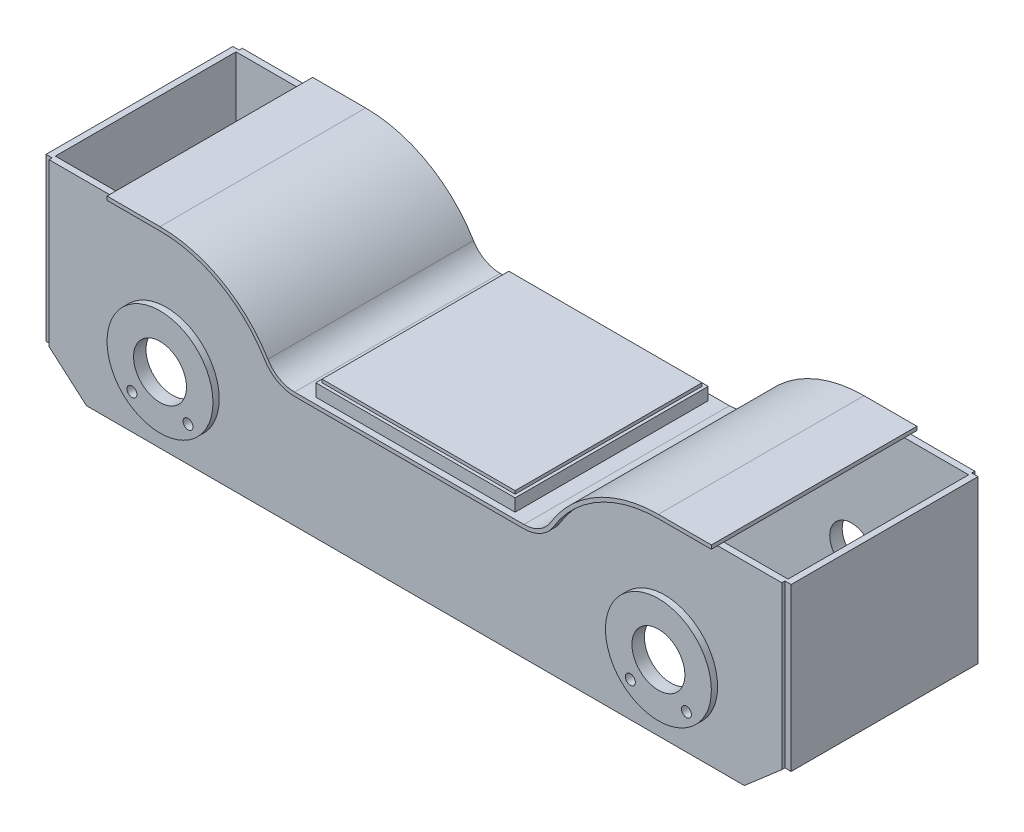
from build123d import *

# Parameters (mm, degrees)
SKETCH_1_R          = 35
SKETCH_1_R_2        = 8
EXTRUDE_1_DEPTH     = 310
SKETCH_2_W          = 1176
SKETCH_2_H          = 290
CUT_EXTRUDE_1_DEPTH = 735.294218961
EXTRUDE_2_DEPTH     = 330
SKETCH_4_R          = 42.5
CUT_EXTRUDE_2_DEPTH = 10
SKETCH_5_R          = 85
SKETCH_5_R_2        = 42.5
SKETCH_5_R_3        = 8
EXTRUDE_3_DEPTH     = 10
SKETCH_6_R          = 85
SKETCH_6_R_2        = 8
SKETCH_6_R_3        = 35
EXTRUDE_4_DEPTH     = 10
SKETCH_7_W          = 10
SKETCH_7_H          = 290
EXTRUDE_5_DEPTH     = 184
SKETCH_8_W          = 420
SKETCH_8_H          = 290
EXTRUDE_6_DEPTH     = 6
SKETCH_9_W          = 10
SKETCH_9_H          = 300
EXTRUDE_7_DEPTH     = 260
SKETCH_10_W         = 320
SKETCH_10_H         = 310
EXTRUDE_8_DEPTH     = 20
SKETCH_11_W         = 310
SKETCH_11_H         = 300
EXTRUDE_9_DEPTH     = 5


with BuildPart() as part:
    # 草图1 → 凸台-拉伸1 (new body)
    with BuildSketch(Plane.XY):
        with BuildLine():
            Line((0, 0), (0, 190))
            Line((0, 190), (184, 190))
            ThreePointArc((184, 190), (211.540328216, 197.240074634), (231.959441014, 217.088202795))
            ThreePointArc((231.959441014, 217.088202795), (303.504043203, 286.632185805), (400, 312))
            Line((400, 312), (588, 312))
            Line((588, 312), (588, 52))
            Line((588, 52), (528, 0))
            Line((528, 0), (0, 0))
        make_face()
        with Locations((400, 116)):
            Circle(SKETCH_1_R, mode=Mode.SUBTRACT)
        with Locations((355, 66)):
            Circle(SKETCH_1_R_2, mode=Mode.SUBTRACT)
        with Locations((445, 66)):
            Circle(SKETCH_1_R_2, mode=Mode.SUBTRACT)
    extrude_1 = extrude(amount=EXTRUDE_1_DEPTH)

    # 镜向1: 凸台-拉伸1 across plane
    add(extrude_1.mirror(Plane(origin=(0, 0, 0), x_dir=(0, 0, 1), z_dir=(1, 0, 0))))

    # 草图2 → 切除-拉伸1 (cut, through all)
    with BuildSketch(Plane(origin=(0, 0, 0), x_dir=(-1, 0, 0), z_dir=(0, -1, 0))):
        with Locations((0, -155)):
            Rectangle(SKETCH_2_W, SKETCH_2_H)
    extrude(amount=-CUT_EXTRUDE_1_DEPTH, mode=Mode.SUBTRACT)


with BuildPart() as cut_extrude_1_piece_1:
    # of the separate pieces the step leaves, piece 1, a body of its own (cut_extrude_1_pieces)
    add(part.part.solids().sort_by_distance((184, 190, 0))[0])



with BuildPart() as cut_extrude_1_piece_2:
    # of the separate pieces the step leaves, piece 2, a body of its own (cut_extrude_1_pieces)
    add(part.part.solids().sort_by_distance((184, 190, 300))[0])

    # 草图4 → 切除-拉伸2 (cut)
    with BuildSketch(Plane.XY.offset(310)):
        with Locations((-400, 116)):
            Circle(SKETCH_4_R)
        with Locations((400, 116)):
            Circle(SKETCH_4_R)
    extrude(amount=-CUT_EXTRUDE_2_DEPTH, mode=Mode.SUBTRACT)


with BuildPart() as body_3:
    # 草图3 → 凸台-拉伸2 (new body)
    with BuildSketch(Plane.XY.offset(320)):
        with BuildLine():
            Line((-184, 190), (184, 190))
            ThreePointArc((184, 190), (211.540328216, 197.240074634), (231.959441014, 217.088202795))
            ThreePointArc((231.959441014, 217.088202795), (303.504043203, 286.632185805), (400, 312))
            Line((400, 312), (485, 312))
            Line((485, 312), (485, 318))
            Line((485, 318), (400, 318))
            ThreePointArc((400, 318), (300.553293751, 291.856463523), (226.820929477, 220.185895353))
            ThreePointArc((226.820929477, 220.185895353), (208.589578764, 202.464352351), (184, 196))
            Line((184, 196), (-184, 196))
            ThreePointArc((-184, 196), (-208.589578764, 202.464352351), (-226.820929477, 220.185895353))
            ThreePointArc((-226.820929477, 220.185895353), (-300.553293751, 291.856463523), (-400, 318))
            Line((-400, 318), (-485, 318))
            Line((-485, 318), (-485, 312))
            Line((-485, 312), (-400, 312))
            ThreePointArc((-400, 312), (-303.504043203, 286.632185805), (-231.959441014, 217.088202795))
            ThreePointArc((-231.959441014, 217.088202795), (-211.540328216, 197.240074634), (-184, 190))
        make_face()
    extrude(amount=-EXTRUDE_2_DEPTH)


    add(cut_extrude_1_piece_2.part)  # 凸台-拉伸3 merges 切除-拉伸1 piece 2
    # 草图5 → 凸台-拉伸3 (add)
    # profile 1 of 2: a face of its own
    with BuildSketch(Plane.XY.offset(310)):
        with Locations((-400, 116)):
            Circle(SKETCH_5_R)
        with Locations((-400, 116)):
            Circle(SKETCH_5_R_2, mode=Mode.SUBTRACT)
        with Locations(Location((-355, 66, 0), (0, 0, 180))):
            Circle(SKETCH_5_R_3, mode=Mode.SUBTRACT)
        with Locations(Location((-445, 66, 0), (0, 0, 180))):
            Circle(SKETCH_5_R_3, mode=Mode.SUBTRACT)
    # profile 2 of 2: a face of its own
    with BuildSketch(Plane.XY.offset(310)):
        with Locations((400, 116)):
            Circle(SKETCH_5_R)
        with Locations(Location((355, 66, 0), (0, 0, 180))):
            Circle(SKETCH_5_R_3, mode=Mode.SUBTRACT)
        with Locations(Location((445, 66, 0), (0, 0, 180))):
            Circle(SKETCH_5_R_3, mode=Mode.SUBTRACT)
        with Locations((400, 116)):
            Circle(SKETCH_5_R_2, mode=Mode.SUBTRACT)
    extrude(amount=EXTRUDE_3_DEPTH)


with BuildPart() as cut_extrude_1_piece_1_1:
    add(cut_extrude_1_piece_1.part)

    add(body_3.part)  # 凸台-拉伸4 merges body 3
    # 草图6 → 凸台-拉伸4 (add)
    # profile 1 of 2: a face of its own
    with BuildSketch(Plane(origin=(0, 0, 0), x_dir=(-1, 0, 0), z_dir=(0, 0, -1))):
        with Locations(Location((-400, 116, 0), (0, 0, 180))):
            Circle(SKETCH_6_R)
        with Locations((-355, 66)):
            Circle(SKETCH_6_R_2, mode=Mode.SUBTRACT)
        with Locations((-445, 66)):
            Circle(SKETCH_6_R_2, mode=Mode.SUBTRACT)
        with Locations((-400, 116)):
            Circle(SKETCH_6_R_3, mode=Mode.SUBTRACT)
    # profile 2 of 2: a face of its own
    with BuildSketch(Plane(origin=(0, 0, 0), x_dir=(-1, 0, 0), z_dir=(0, 0, -1))):
        with Locations(Location((400, 116, 0), (0, 0, 180))):
            Circle(SKETCH_6_R)
        with Locations((445, 66)):
            Circle(SKETCH_6_R_2, mode=Mode.SUBTRACT)
        with Locations((355, 66)):
            Circle(SKETCH_6_R_2, mode=Mode.SUBTRACT)
        with Locations((400, 116)):
            Circle(SKETCH_6_R_3, mode=Mode.SUBTRACT)
    extrude(amount=EXTRUDE_4_DEPTH)

    # 草图7 → 凸台-拉伸5 (add)
    with BuildSketch(Plane(origin=(0, 190, 0), x_dir=(-1, 0, 0), z_dir=(0, -1, 0))):
        with Locations((-105, -155)):
            Rectangle(SKETCH_7_W, SKETCH_7_H)
        with Locations((-155, -155)):
            Rectangle(SKETCH_7_W, SKETCH_7_H)
        with Locations((105, -155)):
            Rectangle(SKETCH_7_W, SKETCH_7_H)
        with Locations((155, -155)):
            Rectangle(SKETCH_7_W, SKETCH_7_H)
    extrude(amount=EXTRUDE_5_DEPTH)

    # 草图8 → 凸台-拉伸6 (add)
    with BuildSketch(Plane.XZ):
        with Locations((0, 155)):
            Rectangle(SKETCH_8_W, SKETCH_8_H)
    extrude(amount=-EXTRUDE_6_DEPTH)

    # 草图9 → 凸台-拉伸7 (add)
    with BuildSketch(Plane(origin=(0, 312, 0), x_dir=(1, 0, 0), z_dir=(0, 1, 0))):
        with Locations((593, -155)):
            Rectangle(SKETCH_9_W, SKETCH_9_H)
        with Locations((-593, -155)):
            Rectangle(SKETCH_9_W, SKETCH_9_H)
    extrude(amount=-EXTRUDE_7_DEPTH)

    # 草图10 → 凸台-拉伸8 (add)
    with BuildSketch(Plane(origin=(0, 196, 0), x_dir=(1, 0, 0), z_dir=(0, 1, 0))):
        with Locations((0, -155)):
            Rectangle(SKETCH_10_W, SKETCH_10_H)
    extrude(amount=EXTRUDE_8_DEPTH)

    # 草图11 → 凸台-拉伸9 (add)
    with BuildSketch(Plane(origin=(0, 216, 0), x_dir=(1, 0, 0), z_dir=(0, 1, 0))):
        with Locations((0, -155)):
            Rectangle(SKETCH_11_W, SKETCH_11_H)
    extrude(amount=EXTRUDE_9_DEPTH)


solid = cut_extrude_1_piece_1_1.part
